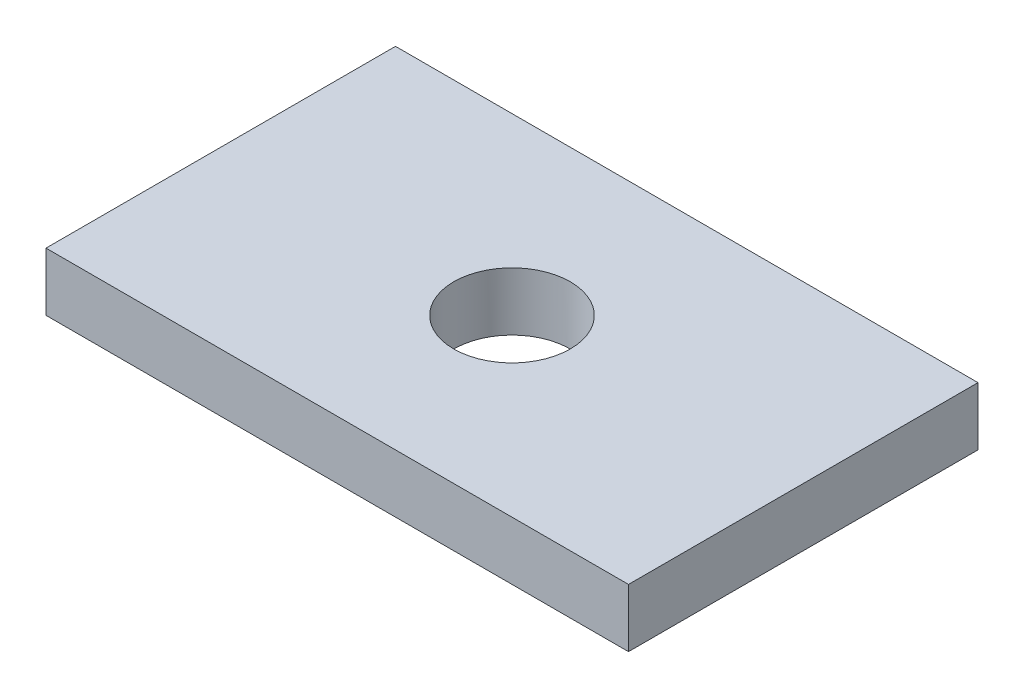
from build123d import *

# Parameters (mm, degrees)
SKETCH1_W               = 127
SKETCH1_H               = 76.2
BOSS_EXTRUDE1_DEPTH     = 12.7
CUT_EXTRUDE1_DEPTH      = 76.134213245
CUT_EXTRUDE1_DEPTH_BACK = 76.134213245
SKETCH2_R               = 12.7


with BuildPart() as part:
    # Sketch1 → Boss-Extrude1 (new body)
    with BuildSketch(Plane(origin=(0, 0, 0), x_dir=(1, 0, 0), z_dir=(0, 1, 0))):
        Rectangle(SKETCH1_W, SKETCH1_H)
    extrude(amount=BOSS_EXTRUDE1_DEPTH)

    # Sketch2 → Cut-Extrude1 (cut, two sides: drawn at the far end of the back side and taken through both)
    with BuildSketch(Plane(origin=(0, 12.7, 0), x_dir=(1, 0, 0), z_dir=(0, 1, 0)).offset(-CUT_EXTRUDE1_DEPTH_BACK)):
        with Locations(Location((0, 0, 0), (0, 0, 270))):
            Circle(SKETCH2_R)
    extrude(amount=CUT_EXTRUDE1_DEPTH + CUT_EXTRUDE1_DEPTH_BACK, mode=Mode.SUBTRACT)


solid = part.part
